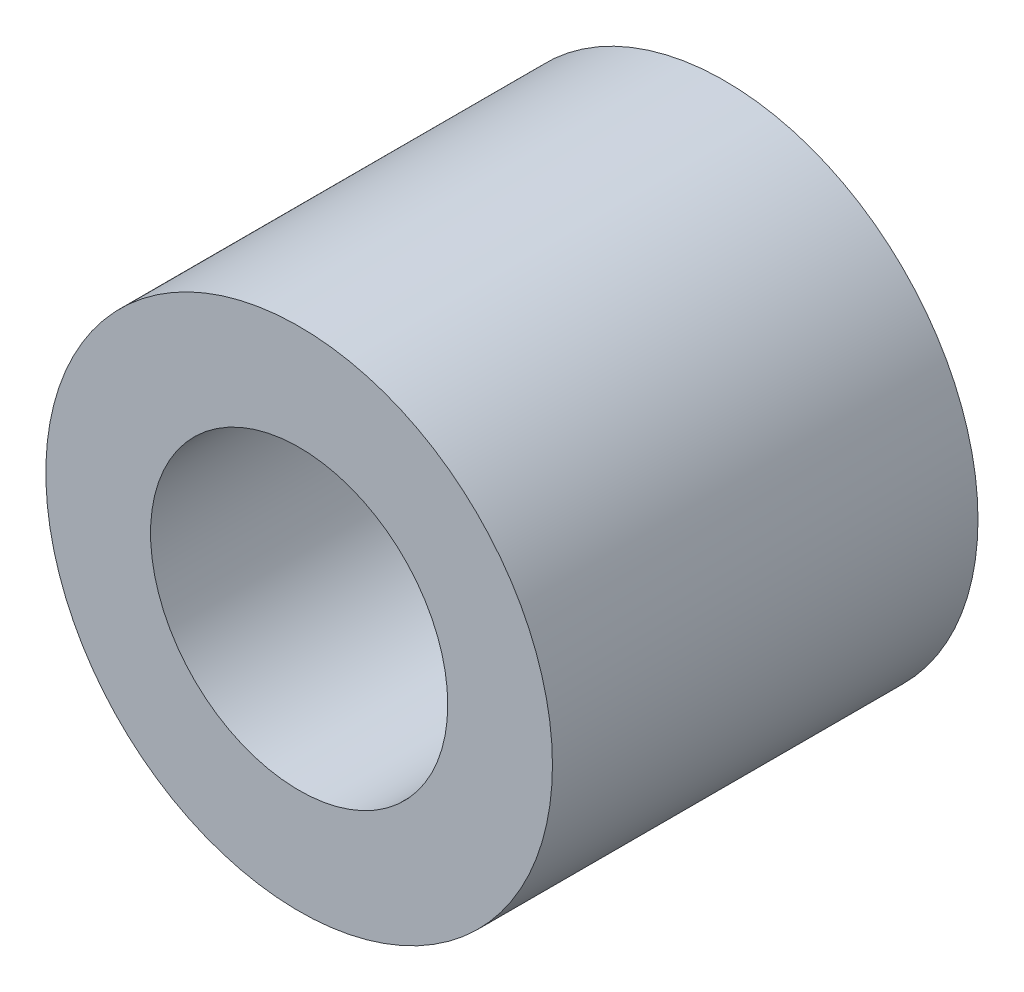
from build123d import *

# Parameters (mm, degrees)
SKETCH1_R           = 4.7625
SKETCH1_R_2         = 2.794
BOSS_EXTRUDE1_DEPTH = 8.001


with BuildPart() as part:
    # Sketch1 → Boss-Extrude1 (new body)
    with BuildSketch(Plane.XY):
        Circle(SKETCH1_R)
        Circle(SKETCH1_R_2, mode=Mode.SUBTRACT)
    extrude(amount=BOSS_EXTRUDE1_DEPTH)


solid = part.part
